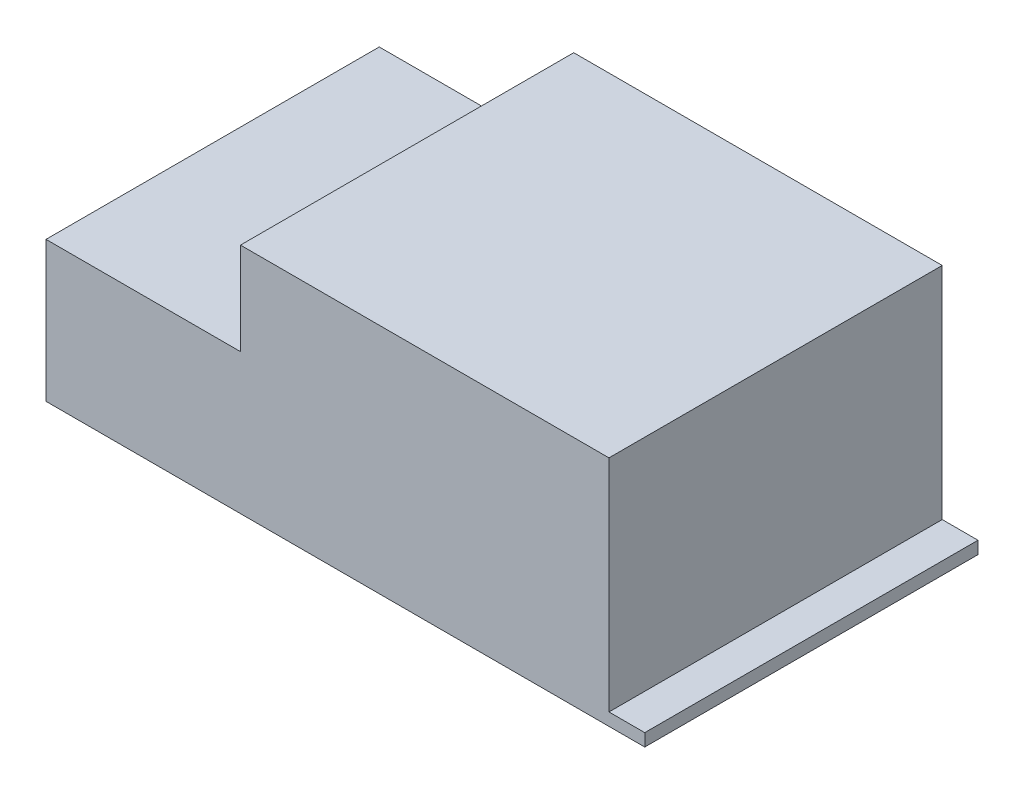
from build123d import *

# Parameters (mm, degrees)
BOSS_EXTRUDE1_DEPTH      = 70.958248
BOSS_EXTRUDE1_DEPTH_BACK = 9.041752
SKETCH3_R                = 5.515432893
CUT_EXTRUDE1_DEPTH       = 22
SKETCH4_W                = 56.790594551
SKETCH4_H                = 75.94381824
CUT_EXTRUDE2_DEPTH       = 31
SKETCH5_W                = 75
SKETCH5_H                = 75.94381824
CUT_EXTRUDE3_DEPTH       = 51


with BuildPart() as part:
    # Sketch1 → Boss-Extrude1 (new, two sides: drawn at the far end of the back side and taken through both)
    with BuildSketch(Plane.XY.offset(-BOSS_EXTRUDE1_DEPTH_BACK)):
        Polygon((97.04953752, 44.971194673), (97.04953752, 47.971194673), (88.459572821, 47.971194673), (88.459572821, 100.803034254), (0, 100.803034254), (0, 78.655691188), (-46.687150509, 78.655691188), (-46.687150509, 44.971194673), align=None)
    extrude(amount=BOSS_EXTRUDE1_DEPTH + BOSS_EXTRUDE1_DEPTH_BACK)

    # Sketch3 → Cut-Extrude1 (cut)
    with BuildSketch(Plane.ZY.offset(46.687150509)):
        with Locations(Location((32.421386427, 59.322946804, 0), (0, 0, 270))):
            Circle(SKETCH3_R)
    extrude(amount=-CUT_EXTRUDE1_DEPTH, mode=Mode.SUBTRACT)

    # Sketch4 → Cut-Extrude2 (cut)
    with BuildSketch(Plane(origin=(0, 44.971194673, 0), x_dir=(-1, 0, 0), z_dir=(0, -1, 0))):
        with Locations((16.345759756, -30.684219126)):
            Rectangle(SKETCH4_W, SKETCH4_H)
    extrude(amount=-CUT_EXTRUDE2_DEPTH, mode=Mode.SUBTRACT)

    # Sketch5 → Cut-Extrude3 (cut)
    with BuildSketch(Plane(origin=(0, 44.971194673, 0), x_dir=(-1, 0, 0), z_dir=(0, -1, 0))):
        with Locations((-49.54953752, -30.684219126)):
            Rectangle(SKETCH5_W, SKETCH5_H)
    extrude(amount=-CUT_EXTRUDE3_DEPTH, mode=Mode.SUBTRACT)


solid = part.part
